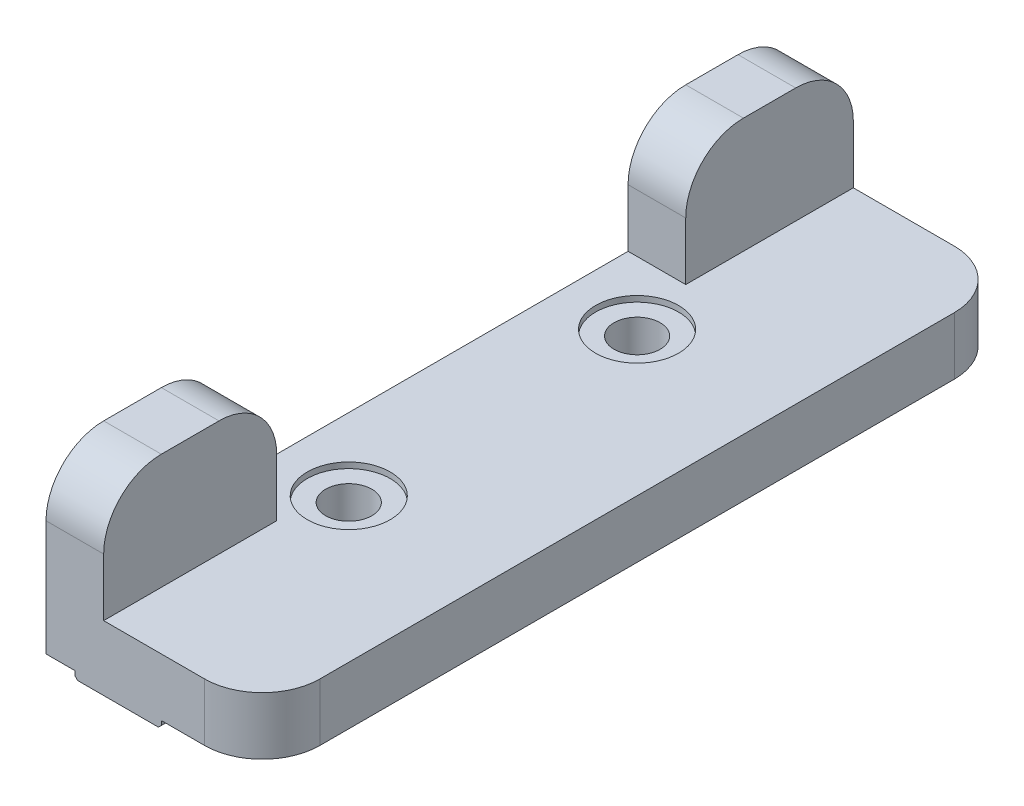
from build123d import *

# Parameters (mm, degrees)
BOSS_EXTRUDE1_DEPTH    = 52
SKETCH5_W              = 6
SKETCH5_H              = 52
BOSS_BOTTOMALIGN_DEPTH = 0.5
FILLET1_SIZE           = 0.2
CUT_BOTTOMHOLE_REACH   = 57.545
SKETCH3_R              = 1.6
SKETCH7_R              = 2.875
CUT_EXTRUDE6_DEPTH     = 0.4
SKETCH6_R              = 3
CUT_MAGNET_DEPTH       = 3
CUT_EXTRUDE7_REACH     = 56.489
SKETCH8_W              = 28.374522614
SKETCH8_H              = 8
FILLET2_R              = 4
FILLET3_R              = 4


with BuildPart() as part:
    # Sketch1 → Boss-Extrude1 (new body)
    with BuildSketch(Plane.XY):
        Polygon((0, 0), (0, 12), (4, 12), (4, 4), (15, 4), (15, 0), align=None)
    extrude(amount=BOSS_EXTRUDE1_DEPTH)

    # Sketch5 → Boss-BottomAlign (add)
    with BuildSketch(Plane.XZ):
        with Locations((5, 26)):
            Rectangle(SKETCH5_W, SKETCH5_H)
    extrude(amount=BOSS_BOTTOMALIGN_DEPTH)

    # Fillet1
    fillet1_edges = [part.edges().sort_by_distance(p)[0] for p in [
        (8, -0.5, 26),
        (2, -0.5, 26),
    ]]
    chamfer(fillet1_edges, length=FILLET1_SIZE)

    # Sketch3 → Cut-BottomHole (cut, up to next)
    with BuildSketch(Plane.XZ.offset(0.5), mode=Mode.PRIVATE) as cut_bottomhole_sk1:
        with Locations(Location((5, 36, 0), (0, 0, 270))):
            Circle(SKETCH3_R)
    cut_bottomhole_tool1 = extrude(cut_bottomhole_sk1.sketch, amount=-CUT_BOTTOMHOLE_REACH, mode=Mode.PRIVATE) & part.part
    # Sketch3 → Cut-BottomHole (cut, up to next)
    with BuildSketch(Plane.XZ.offset(0.5), mode=Mode.PRIVATE) as cut_bottomhole_sk2:
        with Locations(Location((5, 16, 0), (0, 0, 231.317812547))):
            Circle(SKETCH3_R)
    cut_bottomhole_tool2 = extrude(cut_bottomhole_sk2.sketch, amount=-CUT_BOTTOMHOLE_REACH, mode=Mode.PRIVATE) & part.part
    add(cut_bottomhole_tool1.solids().sort_by_distance((5, -0.5, 36))[0], mode=Mode.SUBTRACT)
    add(cut_bottomhole_tool2.solids().sort_by_distance((5, -0.5, 16))[0], mode=Mode.SUBTRACT)

    # Sketch7 → Cut-Extrude6 (cut)
    with BuildSketch(Plane(origin=(0, 4, 0), x_dir=(1, 0, 0), z_dir=(0, 1, 0))):
        with Locations(Location((5, -36, 0), (0, 0, 270))):
            Circle(SKETCH7_R)
        with Locations(Location((5, -16, 0), (0, 0, 270))):
            Circle(SKETCH7_R)
    extrude(amount=-CUT_EXTRUDE6_DEPTH, mode=Mode.SUBTRACT)

    # Sketch6 → Cut-Magnet (cut)
    with BuildSketch(Plane.ZY):
        with Locations((6, 6)):
            Circle(SKETCH6_R)
        with Locations(Location((46, 6, 0), (0, 0, 180))):
            Circle(SKETCH6_R)
    extrude(amount=-CUT_MAGNET_DEPTH, mode=Mode.SUBTRACT)

    # Sketch8 → Cut-Extrude7 (cut, up to next)
    with BuildSketch(Plane(origin=(4, 0, 0), x_dir=(0, 0, -1), z_dir=(1, 0, 0)), mode=Mode.PRIVATE) as cut_extrude7_sk1:
        with Locations((-25.812738693, 8)):
            Rectangle(SKETCH8_W, SKETCH8_H)
    cut_extrude7_tool1 = extrude(cut_extrude7_sk1.sketch, amount=-CUT_EXTRUDE7_REACH, mode=Mode.PRIVATE) & part.part
    add(cut_extrude7_tool1.solids().sort_by_distance((4, 8, 25.812739))[0], mode=Mode.SUBTRACT)

    # Fillet2
    fillet2_edges = [part.edges().sort_by_distance(p)[0] for p in [
        (2, 12, 11.625477386),
        (2, 12, 40),
        (2, 12, 52),
        (2, 12, 0),
    ]]
    fillet(fillet2_edges, radius=FILLET2_R)

    # Fillet3
    fillet3_edges = [part.edges().sort_by_distance(p)[0] for p in [
        (15, 2, 0),
        (15, 2, 52),
    ]]
    fillet(fillet3_edges, radius=FILLET3_R)


solid = part.part
